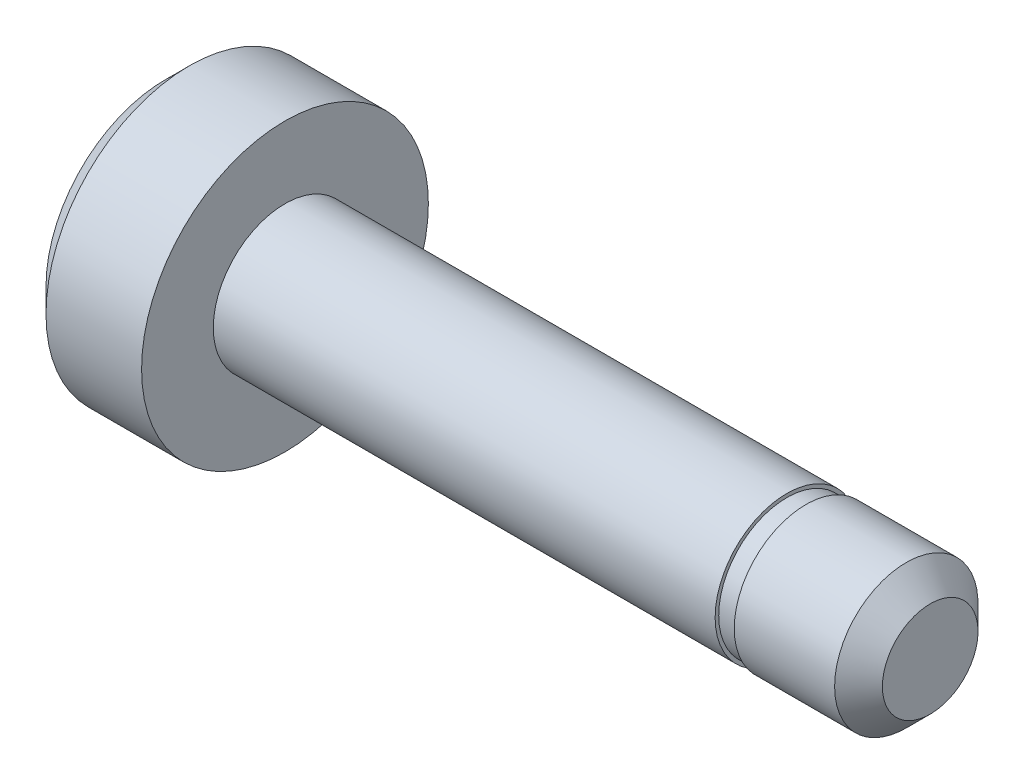
from build123d import *


with BuildPart() as part:
    # Esquisse1 → Révolution1 (revolve)
    with BuildSketch(Plane.XY, mode=Mode.PRIVATE) as r_volution1_sk:
        Polygon((0, 3), (0, 6), (-4, 6), (-5, 5), (-5, 0), (27, 0), (27, 2), (26, 3), (21.8, 3), (21.8, 2.85), (21, 2.85), (21, 3), align=None)
    revolve(r_volution1_sk.sketch.rotate(Axis((-27.093889619, 0, 0), (1, 0, 0)), 90), axis=Axis((-27.093889619, 0, 0), (1, 0, 0)))


solid = part.part
